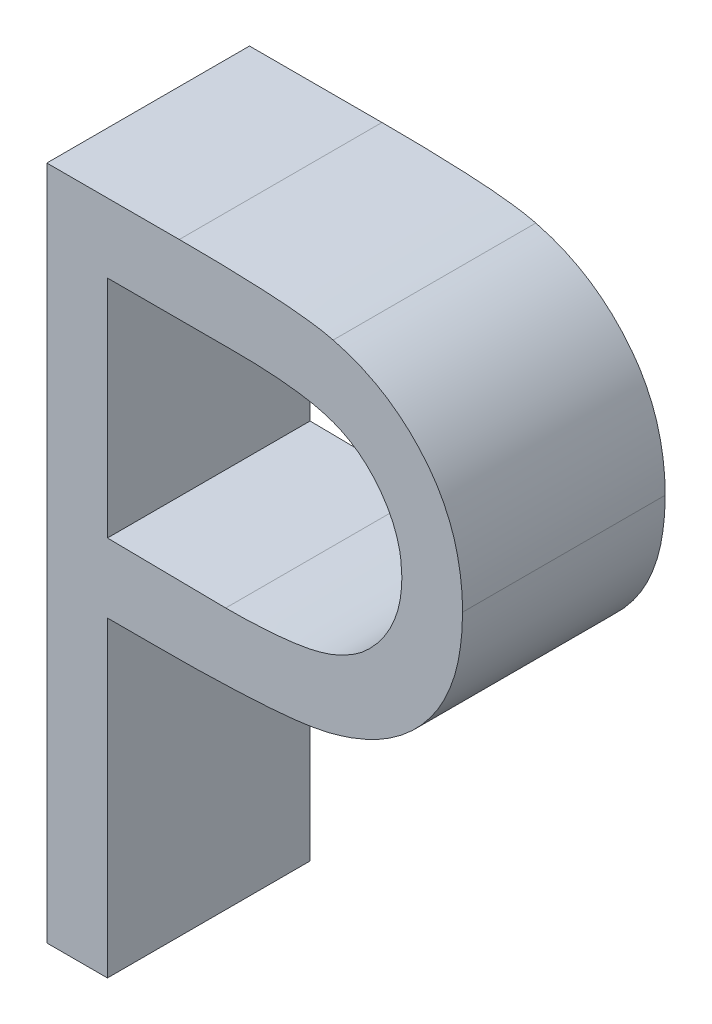
from build123d import *

# Parameters (mm, degrees)
BOSS_EXTRU_1_DEPTH = 1.5


with BuildPart() as part:
    # Esquisse1 → Boss.-Extru.1 (new body)
    with BuildSketch(Plane.XY):
        with BuildLine():
            Line((-55.432465326, -17.870119076), (-54.451896416, -17.870119076))
            add(Edge.make_bspline(
                [(-54.451896416, -17.870119076), (-54.384452264, -17.870193214), (-54.255226274, -17.870335264), (-54.069919052, -17.874642044), (-53.901619435, -17.880394461), (-53.75069032, -17.888368595), (-53.616667322, -17.897792295), (-53.500156894, -17.911009494), (-53.400243242, -17.924809916), (-53.340376886, -17.938840497), (-53.3130743, -17.945239269)],
                knots=[0, 0, 0, 0, 1.415646017, 2.712440637, 3.8905458, 4.950247383, 5.884950622, 6.709939814, 7.411656543, 8, 8, 8, 8], degree=3))
            add(Edge.make_bspline(
                [(-53.3130743, -17.945239269), (-53.278512109, -17.954699197), (-53.210202142, -17.973396142), (-53.11177208, -18.010844319), (-53.018123729, -18.055247412), (-52.928935789, -18.10585304), (-52.845304242, -18.164832417), (-52.765981326, -18.229794728), (-52.691667068, -18.302239826), (-52.622779366, -18.381355169), (-52.559515369, -18.465812612), (-52.505044394, -18.55687294), (-52.459434069, -18.653003374), (-52.42031511, -18.754137047), (-52.392160175, -18.861123223), (-52.370950318, -18.973218527), (-52.357487993, -19.090410941), (-52.356198619, -19.170496466), (-52.355542249, -19.21126491)],
                knots=[0, 0, 0, 0, 0.999701418, 1.975846123, 2.934577507, 3.890451536, 4.834027766, 5.787354733, 6.749476667, 7.726910423, 8.712836071, 9.690891519, 10.682875813, 11.679750201, 12.712814741, 13.765529915, 14.8625177, 16, 16, 16, 16], degree=3))
            add(Edge.make_bspline(
                [(-52.355542249, -19.21126491), (-52.356144284, -19.252376019), (-52.357322207, -19.332812682), (-52.371459758, -19.450488094), (-52.390502888, -19.562942937), (-52.419784392, -19.669927866), (-52.458135353, -19.770807538), (-52.503124, -19.867123584), (-52.557386186, -19.957237401), (-52.619735943, -20.04147614), (-52.689095364, -20.119918872), (-52.76517099, -20.19199715), (-52.847655693, -20.257289062), (-52.936287333, -20.315940982), (-53.031929975, -20.366592809), (-53.133133051, -20.411960388), (-53.240776217, -20.450061903), (-53.315265523, -20.470104848), (-53.353138403, -20.480295358)],
                knots=[0, 0, 0, 0, 1.121902311, 2.195077645, 3.232258892, 4.234102512, 5.217864754, 6.176164875, 7.132989551, 8.084763148, 9.034132444, 9.988522005, 10.94243251, 11.903244335, 12.886203696, 13.894208494, 14.929344452, 16, 16, 16, 16], degree=3))
            add(Edge.make_bspline(
                [(-53.353138403, -20.480295358), (-53.384463166, -20.48695676), (-53.453113205, -20.501555609), (-53.566174236, -20.517853404), (-53.697810502, -20.531764262), (-53.84784233, -20.542194459), (-54.016135052, -20.551123557), (-54.202779705, -20.558220834), (-54.408142673, -20.562120625), (-54.551387307, -20.562321757), (-54.626175262, -20.562426769)],
                knots=[0, 0, 0, 0, 0.601384939, 1.31797006, 2.144135048, 3.087295005, 4.142315834, 5.309527816, 6.595305764, 8, 8, 8, 8], degree=3))
            Line((-54.626175262, -20.562426769), (-54.983747377, -20.562426769))
            Line((-54.983747377, -20.562426769), (-54.983747377, -22.870119076))
            Line((-54.983747377, -22.870119076), (-55.432465326, -22.870119076))
            Line((-55.432465326, -22.870119076), (-55.432465326, -17.870119076))
        make_face()
        with BuildLine():
            Line((-54.983747377, -18.382939589), (-54.983747377, -20.049606256))
            Line((-54.983747377, -20.049606256), (-54.108346736, -20.060623884))
            add(Edge.make_bspline(
                [(-54.108346736, -20.060623884), (-54.065603985, -20.060645975), (-53.983089985, -20.060688621), (-53.86389538, -20.054995444), (-53.753310684, -20.048423255), (-53.651675577, -20.038800507), (-53.558944242, -20.025198711), (-53.474962058, -20.011467656), (-53.400380225, -19.991602853), (-53.313095651, -19.964855611), (-53.215833726, -19.919237589), (-53.110022942, -19.85302346), (-53.020350676, -19.768622448), (-52.942753109, -19.673725546), (-52.881173284, -19.568155362), (-52.836093295, -19.455199738), (-52.809605927, -19.336017095), (-52.806054222, -19.254462611), (-52.804260198, -19.213268115)],
                knots=[0, 0, 0, 0, 1.160613943, 2.240541288, 3.23993089, 4.169200891, 5.011653406, 5.7853311, 6.478053781, 7.106038997, 8.262395093, 9.384106736, 10.481365981, 11.59014053, 12.70357646, 13.786202915, 14.881775077, 16, 16, 16, 16], degree=3))
            add(Edge.make_bspline(
                [(-52.804260198, -19.213268115), (-52.806063978, -19.173070238), (-52.809649671, -19.093161835), (-52.836300904, -18.97604932), (-52.881085638, -18.864284028), (-52.943166488, -18.760036763), (-53.018510959, -18.665481329), (-53.106081449, -18.583342576), (-53.205671823, -18.517311572), (-53.298312153, -18.474692598), (-53.380599561, -18.448670776), (-53.45207379, -18.430463861), (-53.532774753, -18.415927281), (-53.622728724, -18.404156563), (-53.721238487, -18.39408019), (-53.829150365, -18.387243079), (-53.94605557, -18.383240999), (-54.027213528, -18.383042491), (-54.069284236, -18.382939589)],
                knots=[0, 0, 0, 0, 1.120700087, 2.227813068, 3.331159281, 4.466773991, 5.599788987, 6.693661531, 7.80175334, 8.91857717, 9.525282508, 10.207424825, 10.974604443, 11.810962634, 12.737642355, 13.736264703, 14.826523623, 16, 16, 16, 16], degree=3))
            Line((-54.069284236, -18.382939589), (-54.983747377, -18.382939589))
        make_face(mode=Mode.SUBTRACT)
    extrude(amount=BOSS_EXTRU_1_DEPTH)


solid = part.part
